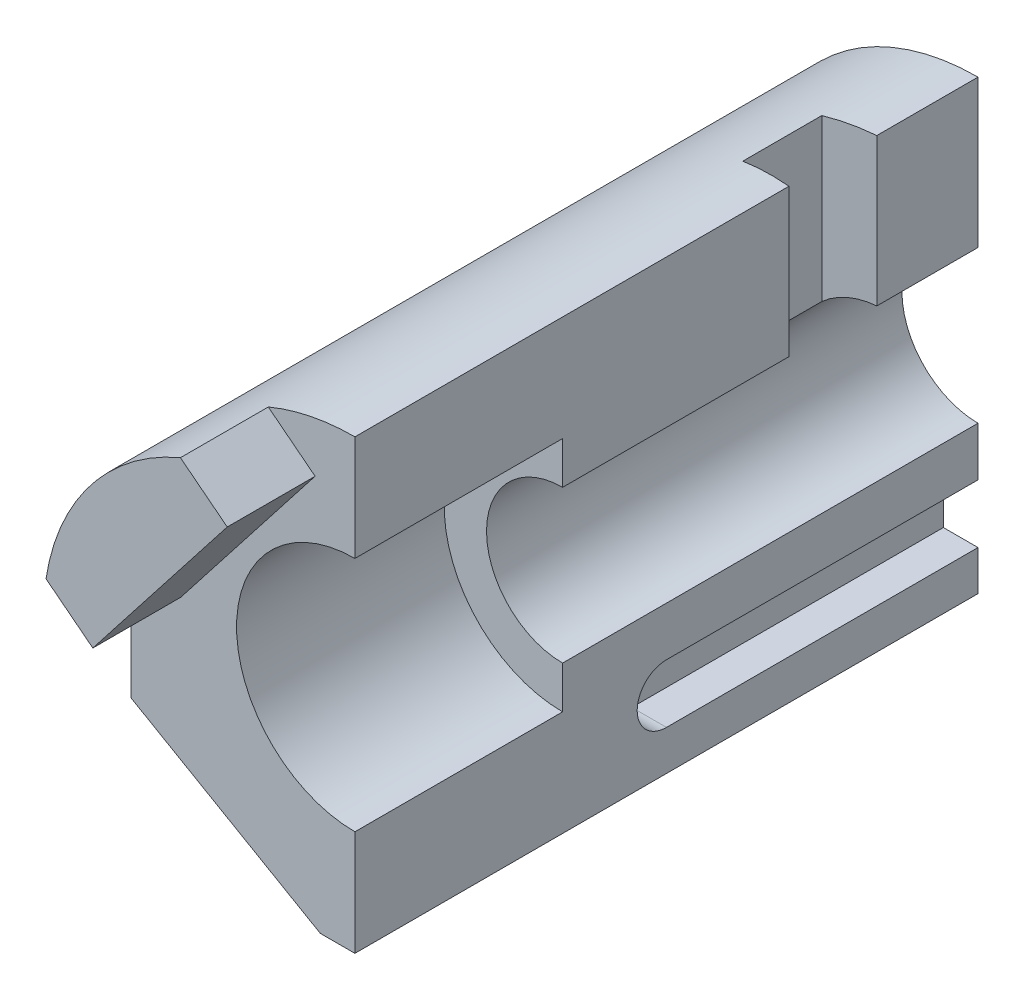
from build123d import *

# Parameters (mm, degrees)
BOSS_EXTRUDE1_DEPTH     = 234
SKETCH2_R               = 44.45
CUT_EXTRUDE2_DEPTH      = 78
SKETCH3_R               = 28.575
CUT_EXTRUDE3_DEPTH      = 301.059994001
CUT_EXTRUDE4_DEPTH      = 13
BOSS_EXTRUDE2_START     = 33
BOSS_EXTRUDE2_DEPTH     = 33
CUT_EXTRUDE6_REACH      = 302.06
CUT_EXTRUDE6_END_RADIUS = 28.575


with BuildPart() as part:
    # Sketch1 → Boss-Extrude1 (new body)
    with BuildSketch(Plane.XY):
        with BuildLine():
            Line((0, 0), (-13, 0))
            Line((-13, 0), (-84, 40.991869112))
            Line((-84, 40.991869112), (-84, 84))
            ThreePointArc((-84, 84), (-59.39696962, 143.39696962), (0, 168))
            Line((0, 168), (0, 0))
        make_face()
    extrude(amount=-BOSS_EXTRUDE1_DEPTH)

    # Sketch2 → Cut-Extrude2 (cut)
    with BuildSketch(Plane.XY):
        with Locations((0, 84)):
            Circle(SKETCH2_R)
    extrude(amount=-CUT_EXTRUDE2_DEPTH, mode=Mode.SUBTRACT)

    # Sketch3 → Cut-Extrude3 (cut, through all)
    with BuildSketch(Plane.XY):
        with Locations((0, 84)):
            Circle(SKETCH3_R)
    extrude(amount=-CUT_EXTRUDE3_DEPTH, mode=Mode.SUBTRACT)

    # Sketch5 → Cut-Extrude4 (cut)
    with BuildSketch(Plane(origin=(0, 0, 0), x_dir=(0, 0, -1), z_dir=(1, 0, 0))):
        with BuildLine():
            Line((234, 15), (117, 15))
            ThreePointArc((117, 15), (106, 26), (117, 37))
            Line((117, 37), (234, 37))
            ThreePointArc((234, 37), (245, 26), (234, 15))
        make_face()
    extrude(amount=-CUT_EXTRUDE4_DEPTH, mode=Mode.SUBTRACT)

    # Sketch6 → Boss-Extrude2 (add)
    with BuildSketch(Plane.XY.offset(BOSS_EXTRUDE2_START)):
        with BuildLine():
            Line((-40.188548434, 115.398735242), (-14.946427946, 147.707176139))
            Line((-14.946427946, 147.707176139), (-32.530408402, 161.445287327))
            ThreePointArc((-32.530408402, 161.445287327), (-66.192903303, 135.715563927), (-83.014649379, 96.828405531))
            Line((-83.014649379, 96.828405531), (-65.430668922, 83.090294344))
            Line((-65.430668922, 83.090294344), (-40.188548434, 115.398735242))
        make_face()
    extrude(amount=-BOSS_EXTRUDE2_DEPTH)

    # Cut-Extrude6: up to this cylinder (the profile starts outside it)
    cut_extrude6_end = Plane(origin=(0, 84, -179.5), z_dir=(0, 0, 1)) * Cylinder(CUT_EXTRUDE6_END_RADIUS, 662.27, mode=Mode.PRIVATE)
    # Sketch7 → Cut-Extrude6 (cut, up to the surface)
    with BuildSketch(Plane(origin=(0, 168, 0), x_dir=(1, 0, 0), z_dir=(0, 1, 0)), mode=Mode.PRIVATE) as cut_extrude6_sk1:
        Polygon((0, 196), (-19, 194.337715393), (-19, 164.662284607), (0, 163), align=None)
    cut_extrude6_tool1 = extrude(cut_extrude6_sk1.sketch, amount=-CUT_EXTRUDE6_REACH, mode=Mode.PRIVATE) - cut_extrude6_end
    add(cut_extrude6_tool1.solids().sort_by_distance((-9.332027, 168, -179.5))[0], mode=Mode.SUBTRACT)


solid = part.part
